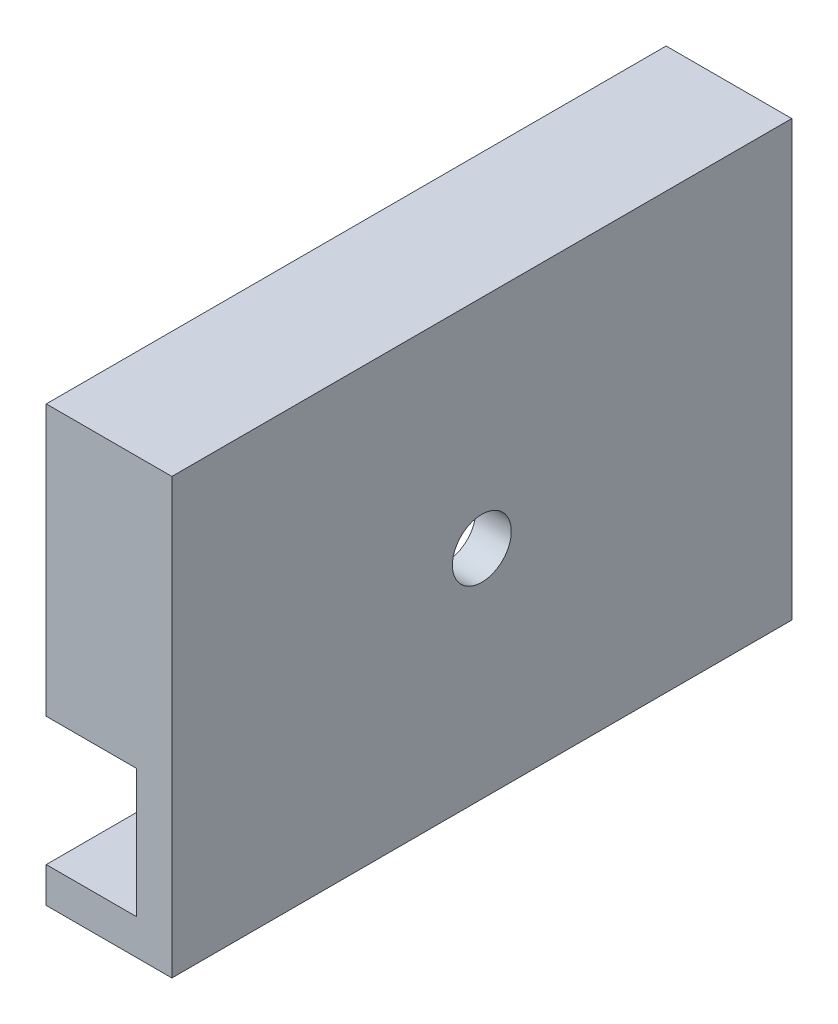
from build123d import *

# Parameters (mm, degrees)
EXTRUDE_THIN1_DEPTH = 88.9
SKETCH2_R           = 4.22275
CUT_EXTRUDE2_DEPTH  = 5.08
SKETCH3_W           = 18.017998
SKETCH3_H           = 38.7985
BOSS_EXTRUDE1_DEPTH = 5.08
SKETCH4_W           = 18.017998
SKETCH4_H           = 38.7985
BOSS_EXTRUDE2_DEPTH = 5.08


with BuildPart() as part:
    # Sketch1 → Extrude-Thin1 (new body)
    with BuildSketch(Plane.XY):
        Polygon((-6.468999, 26.06675), (6.468999, 26.06675), (6.468999, -26.06675), (-6.468999, -26.06675), (-6.468999, -31.14675), (11.548999, -31.14675), (11.548999, 31.14675), (-6.468999, 31.14675), align=None)
    extrude(amount=EXTRUDE_THIN1_DEPTH)

    # Sketch2 → Cut-Extrude2 (cut)
    with BuildSketch(Plane.ZY.offset(-6.468999)):
        with Locations((44.45, 0)):
            Circle(SKETCH2_R)
    extrude(amount=-CUT_EXTRUDE2_DEPTH, mode=Mode.SUBTRACT)

    # Sketch3 → Boss-Extrude1 (add)
    with BuildSketch(Plane.XY.offset(88.9)):
        with Locations((2.54, 11.7475)):
            Rectangle(SKETCH3_W, SKETCH3_H)
    extrude(amount=-BOSS_EXTRUDE1_DEPTH)

    # Sketch4 → Boss-Extrude2 (add)
    with BuildSketch(Plane(origin=(0, 0, 0), x_dir=(-1, 0, 0), z_dir=(0, 0, -1))):
        with Locations((-2.54, -11.7475)):
            Rectangle(SKETCH4_W, SKETCH4_H)
    extrude(amount=-BOSS_EXTRUDE2_DEPTH)


solid = part.part
